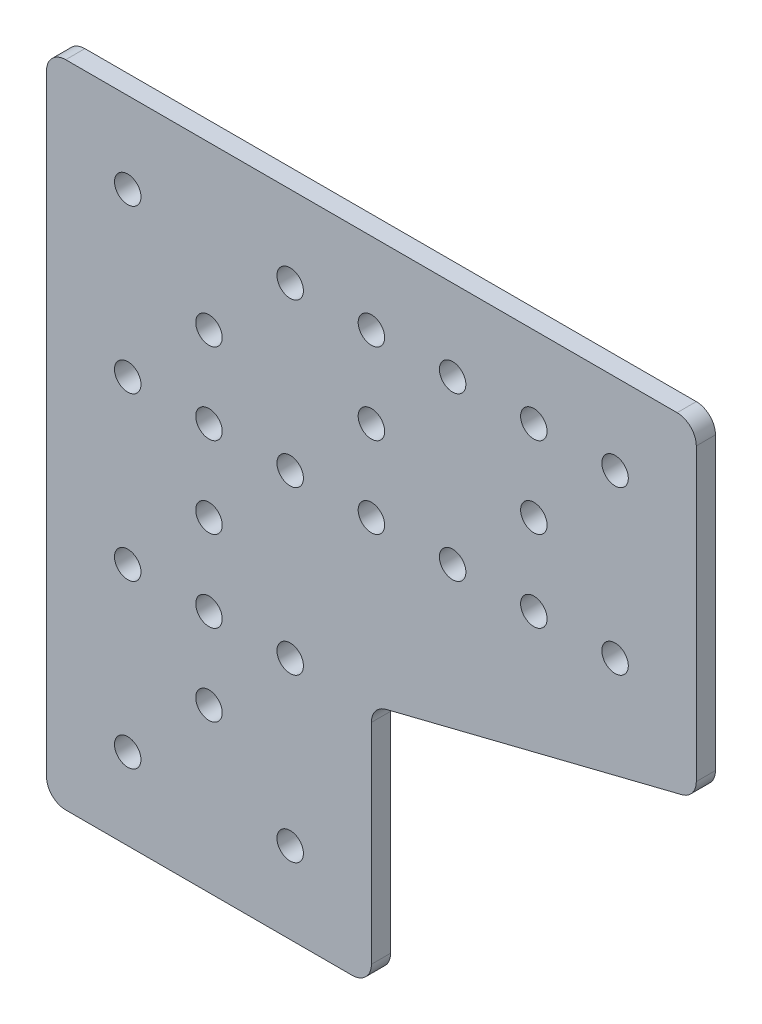
from build123d import *

# Parameters (mm, degrees)
SKETCH3_R           = 2.07
BOSS_EXTRUDE1_DEPTH = 1.5
FILLET1_R           = 3


with BuildPart() as part:
    # Sketch3 → Boss-Extrude1 (new, symmetric)
    with BuildSketch(Plane.XY):
        Polygon((0, 0), (0, -101.6), (50.8, -101.6), (50.8, -63.5), (101.6, -50.8), (101.6, 0), (50.8, 0), align=None)
        with Locations((12.7, -88.9)):
            Circle(SKETCH3_R, mode=Mode.SUBTRACT)
        with Locations((12.7, -63.5)):
            Circle(SKETCH3_R, mode=Mode.SUBTRACT)
        with Locations((12.7, -38.1)):
            Circle(SKETCH3_R, mode=Mode.SUBTRACT)
        with Locations((12.7, -12.7)):
            Circle(SKETCH3_R, mode=Mode.SUBTRACT)
        with Locations(Location((38.1, -12.7, 0), (0, 0, 180))):
            Circle(SKETCH3_R, mode=Mode.SUBTRACT)
        with Locations(Location((38.1, -38.1, 0), (0, 0, 180))):
            Circle(SKETCH3_R, mode=Mode.SUBTRACT)
        with Locations(Location((38.1, -63.5, 0), (0, 0, 180))):
            Circle(SKETCH3_R, mode=Mode.SUBTRACT)
        with Locations(Location((38.1, -88.9, 0), (0, 0, 180))):
            Circle(SKETCH3_R, mode=Mode.SUBTRACT)
        with Locations((25.4, -76.2)):
            Circle(SKETCH3_R, mode=Mode.SUBTRACT)
        with Locations((25.4, -63.5)):
            Circle(SKETCH3_R, mode=Mode.SUBTRACT)
        with Locations((25.4, -50.8)):
            Circle(SKETCH3_R, mode=Mode.SUBTRACT)
        with Locations((25.4, -38.1)):
            Circle(SKETCH3_R, mode=Mode.SUBTRACT)
        with Locations((25.4, -25.4)):
            Circle(SKETCH3_R, mode=Mode.SUBTRACT)
        with Locations(Location((50.8, -12.7, 0), (0, 0, 180))):
            Circle(SKETCH3_R, mode=Mode.SUBTRACT)
        with Locations(Location((50.8, -38.1, 0), (0, 0, 180))):
            Circle(SKETCH3_R, mode=Mode.SUBTRACT)
        with Locations(Location((63.5, -12.7, 0), (0, 0, 180))):
            Circle(SKETCH3_R, mode=Mode.SUBTRACT)
        with Locations(Location((63.5, -38.1, 0), (0, 0, 180))):
            Circle(SKETCH3_R, mode=Mode.SUBTRACT)
        with Locations(Location((76.2, -12.7, 0), (0, 0, 180))):
            Circle(SKETCH3_R, mode=Mode.SUBTRACT)
        with Locations(Location((76.2, -38.1, 0), (0, 0, 180))):
            Circle(SKETCH3_R, mode=Mode.SUBTRACT)
        with Locations(Location((88.9, -12.7, 0), (0, 0, 180))):
            Circle(SKETCH3_R, mode=Mode.SUBTRACT)
        with Locations(Location((88.9, -38.1, 0), (0, 0, 180))):
            Circle(SKETCH3_R, mode=Mode.SUBTRACT)
        with Locations((50.8, -25.4)):
            Circle(SKETCH3_R, mode=Mode.SUBTRACT)
        with Locations((76.2, -25.4)):
            Circle(SKETCH3_R, mode=Mode.SUBTRACT)
    extrude(amount=BOSS_EXTRUDE1_DEPTH, both=True)

    # Fillet1
    fillet1_edges = [part.edges().sort_by_distance(p)[0] for p in [
        (101.6, 0, 0),
        (101.6, -50.8, 0),
        (50.8, -63.5, 0),
        (50.8, -101.6, 0),
        (0, -101.6, 0),
        (0, 0, 0),
    ]]
    fillet(fillet1_edges, radius=FILLET1_R)


solid = part.part
